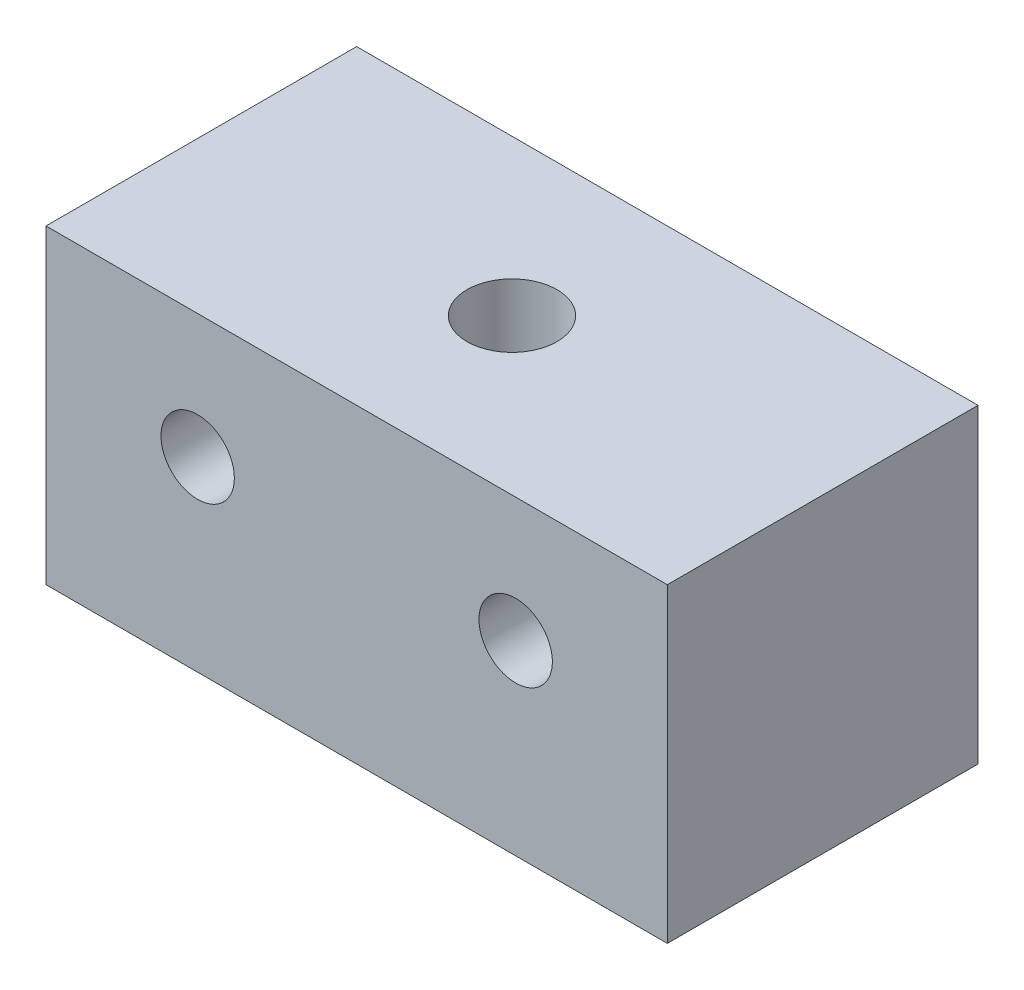
from build123d import *

# Parameters (mm, degrees)
SKETCH1_W           = 25.4
SKETCH1_H           = 12.7
BOSS_EXTRUDE1_DEPTH = 12.7
SKETCH2_R           = 1.5
CUT_EXTRUDE1_DEPTH  = 32.108519733
SKETCH3_R           = 1.8415
CUT_EXTRUDE2_DEPTH  = 32.108519733


with BuildPart() as part:
    # Sketch1 → Boss-Extrude1 (new body)
    with BuildSketch(Plane(origin=(0, 0, 0), x_dir=(1, 0, 0), z_dir=(0, 1, 0))):
        with Locations((12.7, 6.35)):
            Rectangle(SKETCH1_W, SKETCH1_H)
    extrude(amount=BOSS_EXTRUDE1_DEPTH)

    # Sketch2 → Cut-Extrude1 (cut, through all)
    with BuildSketch(Plane.XY):
        with Locations((6.2, 7.62)):
            Circle(SKETCH2_R)
        with Locations(Location((19.2, 7.62, 0), (0, 0, 180))):
            Circle(SKETCH2_R)
    extrude(amount=-CUT_EXTRUDE1_DEPTH, mode=Mode.SUBTRACT)

    # Sketch3 → Cut-Extrude2 (cut, through all)
    with BuildSketch(Plane(origin=(0, 12.7, 0), x_dir=(1, 0, 0), z_dir=(0, 1, 0))):
        with Locations(Location((12.7, 6.35, 0), (0, 0, 270))):
            Circle(SKETCH3_R)
    extrude(amount=-CUT_EXTRUDE2_DEPTH, mode=Mode.SUBTRACT)


solid = part.part
